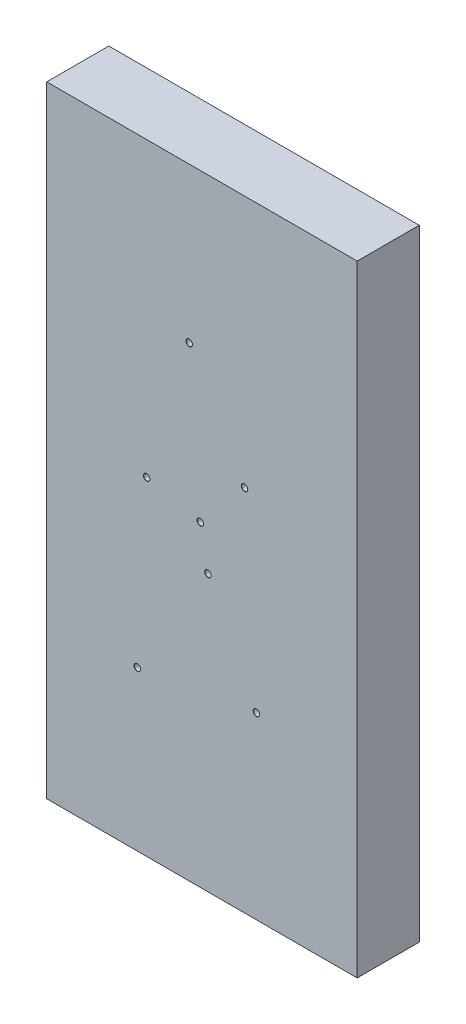
from build123d import *

# Parameters (mm, degrees)
SKETCH1_W                          = 50
SKETCH1_H                          = 100
BOSS_EXTRUDE1_DEPTH                = 10
F_1_0_1_DIAMETER_HOLE1_D           = 1
F_1_0_1_DIAMETER_HOLE1_CSINK_D     = 1.05
F_1_0_1_DIAMETER_HOLE1_CSINK_ANGLE = 90


with BuildPart() as part:
    # Sketch1 → Boss-Extrude1 (new body)
    with BuildSketch(Plane.XY):
        Rectangle(SKETCH1_W, SKETCH1_H)
    extrude(amount=BOSS_EXTRUDE1_DEPTH)

    # Ø1.0 (1) Diameter Hole1 (through all)
    with Locations(Plane(origin=(-10.416398975, -24.396302864, 10), x_dir=(1, 0, 0), z_dir=(0, 0, 1))):
        with Locations((0, 0), (10.142283212, 25.355708033), (11.375804144, 18.776929732), (1.507636693, 27.27451837), (17.269293038, 33.716238789), (8.360530756, 49.477895134), (19.188103375, 3.289389151)):
            CounterSinkHole(F_1_0_1_DIAMETER_HOLE1_D / 2, F_1_0_1_DIAMETER_HOLE1_CSINK_D / 2, counter_sink_angle=F_1_0_1_DIAMETER_HOLE1_CSINK_ANGLE)


solid = part.part
